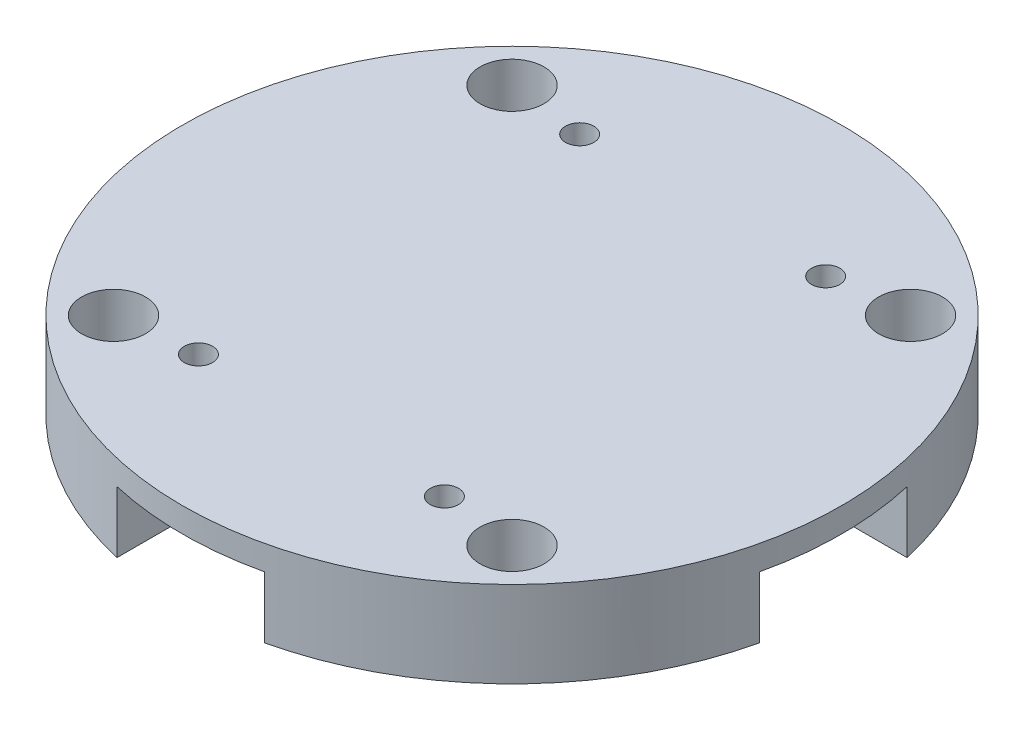
from build123d import *

# Parameters (mm, degrees)
EXTRUDE_2_DEPTH          = 5
EXTRUDE_2_2_DEPTH        = 5
EXTRUDE_2_3_DEPTH        = 5
EXTRUDE_2_4_DEPTH        = 5
SKETCH_5_R               = 0.65
CUT_EXTRUDE_2_DEPTH      = 5
SKETCH_7_R               = 26.8
EXTRUDE_3_DEPTH          = 2
CUT_EXTRUDE_3_DEPTH      = 39.541925224
CUT_EXTRUDE_3_DEPTH_BACK = 4.5
SKETCH_6_R               = 2.6
SKETCH_8_R               = 1.15
CUT_EXTRUDE_4_DEPTH      = 3.3


with BuildPart() as part:
    # 草图4 → 凸台-拉伸2 (new body)
    with BuildSketch(Plane(origin=(0, 0, 0), x_dir=(1, 0, 0), z_dir=(0, 1, 0))):
        with BuildLine():
            ThreePointArc((-6, 26.119724348), (-18.950461736, 18.950461736), (-26.119724348, 6))
            Line((-26.119724348, 6), (-6, 6))
            Line((-6, 6), (-6, 26.119724348))
        make_face()
    extrude(amount=EXTRUDE_2_DEPTH)


with BuildPart() as body_2:
    # 草图4 → Extrude 2 2 (new body)
    with BuildSketch(Plane(origin=(0, 0, 0), x_dir=(1, 0, 0), z_dir=(0, 1, 0))):
        with BuildLine():
            Line((6, 26.119724348), (6, 6))
            Line((6, 6), (26.119724348, 6))
            ThreePointArc((26.119724348, 6), (18.950461736, 18.950461736), (6, 26.119724348))
        make_face()
    extrude(amount=EXTRUDE_2_2_DEPTH)


with BuildPart() as body_3:
    # 草图4 → Extrude 2 3 (new body)
    with BuildSketch(Plane(origin=(0, 0, 0), x_dir=(1, 0, 0), z_dir=(0, 1, 0))):
        with BuildLine():
            Line((-6, -6), (-26.119724348, -6))
            ThreePointArc((-26.119724348, -6), (-18.950461736, -18.950461736), (-6, -26.119724348))
            Line((-6, -26.119724348), (-6, -6))
        make_face()
    extrude(amount=EXTRUDE_2_3_DEPTH)


with BuildPart() as body_4:
    # 草图4 → Extrude 2 4 (new body)
    with BuildSketch(Plane(origin=(0, 0, 0), x_dir=(1, 0, 0), z_dir=(0, 1, 0))):
        with BuildLine():
            ThreePointArc((6, -26.119724348), (18.950461736, -18.950461736), (26.119724348, -6))
            Line((26.119724348, -6), (6, -6))
            Line((6, -6), (6, -26.119724348))
        make_face()
    extrude(amount=EXTRUDE_2_4_DEPTH)


with BuildPart() as cut_extrude_2_tool:
    # 草图5 → 切除-拉伸2 (new body)
    with BuildSketch(Plane(origin=(0, 5, 0), x_dir=(1, 0, 0), z_dir=(0, 1, 0))):
        with Locations(Location((16.2, 16.2, 0), (0, 0, 270))):
            Circle(SKETCH_5_R)
        with Locations(Location((16.2, -16.2, 0), (0, 0, 270))):
            Circle(SKETCH_5_R)
        with Locations(Location((-16.2, -16.2, 0), (0, 0, 270))):
            Circle(SKETCH_5_R)
        with Locations(Location((-16.2, 16.2, 0), (0, 0, 270))):
            Circle(SKETCH_5_R)
    extrude(amount=-CUT_EXTRUDE_2_DEPTH)


with BuildPart() as part_1:
    add(part.part)

    # 切除-拉伸2: cut by cut_extrude_2_tool
    add(cut_extrude_2_tool.part, mode=Mode.SUBTRACT)



with BuildPart() as body_2_1:
    add(body_2.part)

    # 切除-拉伸2: cut by cut_extrude_2_tool
    add(cut_extrude_2_tool.part, mode=Mode.SUBTRACT)


with BuildPart() as body_3_1:
    add(body_3.part)

    # 切除-拉伸2: cut by cut_extrude_2_tool
    add(cut_extrude_2_tool.part, mode=Mode.SUBTRACT)


with BuildPart() as body_4_1:
    add(body_4.part)

    # 切除-拉伸2: cut by cut_extrude_2_tool
    add(cut_extrude_2_tool.part, mode=Mode.SUBTRACT)


with BuildPart() as part_2:
    add(part_1.part)

    add(body_2_1.part)  # 凸台-拉伸3 merges body 2

    add(body_3_1.part)  # 凸台-拉伸3 merges body 3

    add(body_4_1.part)  # 凸台-拉伸3 merges body 4
    # 草图7 → 凸台-拉伸3 (add)
    with BuildSketch(Plane(origin=(0, 5, 0), x_dir=(1, 0, 0), z_dir=(0, 1, 0))):
        with Locations(Location((0, 0, 0), (0, 0, 77.062938021))):
            Circle(SKETCH_7_R)
    extrude(amount=EXTRUDE_3_DEPTH)

    # 草图6 → 切除-拉伸3 (cut, two sides: drawn at the far end of the back side and taken through both)
    with BuildSketch(Plane(origin=(0, 7, 0), x_dir=(1, 0, 0), z_dir=(0, 1, 0)).offset(-CUT_EXTRUDE_3_DEPTH_BACK)):
        with Locations(Location((16.2, 16.2, 0), (0, 0, 90))):
            Circle(SKETCH_6_R)
        with Locations(Location((16.2, -16.2, 0), (0, 0, 90))):
            Circle(SKETCH_6_R)
        with Locations(Location((-16.2, -16.2, 0), (0, 0, 90))):
            Circle(SKETCH_6_R)
        with Locations(Location((-16.2, 16.2, 0), (0, 0, 90))):
            Circle(SKETCH_6_R)
    extrude(amount=CUT_EXTRUDE_3_DEPTH + CUT_EXTRUDE_3_DEPTH_BACK, mode=Mode.SUBTRACT)

    # 草图8 → 切除-拉伸4 (cut)
    with BuildSketch(Plane(origin=(0, 7, 0), x_dir=(1, 0, 0), z_dir=(0, 1, 0))):
        with Locations(Location((10, -15.5, 0), (0, 0, 270))):
            Circle(SKETCH_8_R)
        with Locations(Location((-10, -15.5, 0), (0, 0, 270))):
            Circle(SKETCH_8_R)
        with Locations(Location((10, 15.5, 0), (0, 0, 270))):
            Circle(SKETCH_8_R)
        with Locations(Location((-10, 15.5, 0), (0, 0, 270))):
            Circle(SKETCH_8_R)
    extrude(amount=-CUT_EXTRUDE_4_DEPTH, mode=Mode.SUBTRACT)


solid = part_2.part
